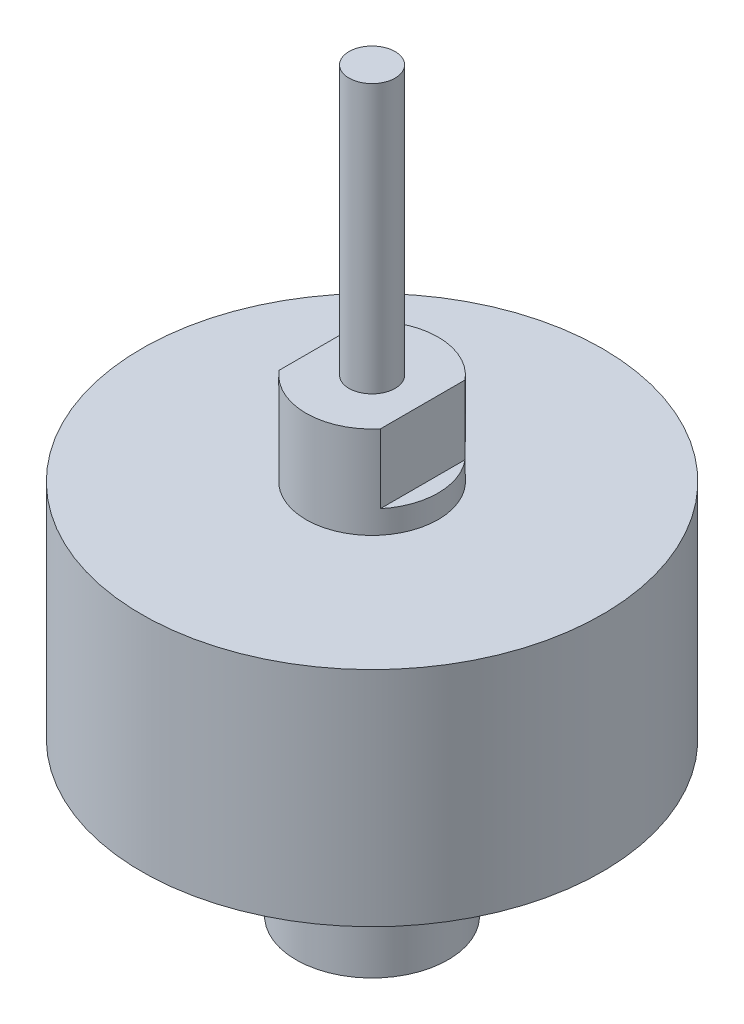
from build123d import *

# Parameters (mm, degrees)
SKETCH1_R           = 4.95
BOSS_EXTRUDE1_DEPTH = 6
SKETCH2_R           = 5.5
BOSS_EXTRUDE2_DEPTH = 4
SKETCH3_R           = 15
BOSS_EXTRUDE3_DEPTH = 14.5
SKETCH4_R           = 4.3
BOSS_EXTRUDE4_DEPTH = 1.5
BOSS_EXTRUDE5_DEPTH = 4.5
SKETCH6_R           = 1.5
BOSS_EXTRUDE6_DEPTH = 17.5


with BuildPart() as part:
    # Sketch1 → Boss-Extrude1 (new body)
    with BuildSketch(Plane(origin=(0, 0, 0), x_dir=(1, 0, 0), z_dir=(0, 1, 0))):
        with Locations(Location((0, 0, 0), (0, 0, 270))):
            Circle(SKETCH1_R)
    extrude(amount=BOSS_EXTRUDE1_DEPTH)

    # Sketch2 → Boss-Extrude2 (add)
    with BuildSketch(Plane(origin=(0, 6, 0), x_dir=(1, 0, 0), z_dir=(0, 1, 0))):
        with Locations(Location((0, 0, 0), (0, 0, 270))):
            Circle(SKETCH2_R)
    extrude(amount=BOSS_EXTRUDE2_DEPTH)

    # Sketch3 → Boss-Extrude3 (add)
    with BuildSketch(Plane(origin=(0, 10, 0), x_dir=(1, 0, 0), z_dir=(0, 1, 0))):
        with Locations(Location((0, 0, 0), (0, 0, 90))):
            Circle(SKETCH3_R)
    extrude(amount=BOSS_EXTRUDE3_DEPTH)

    # Sketch4 → Boss-Extrude4 (add)
    with BuildSketch(Plane(origin=(0, 24.5, 0), x_dir=(1, 0, 0), z_dir=(0, 1, 0))):
        with Locations(Location((0, 0, 0), (0, 0, 270))):
            Circle(SKETCH4_R)
    extrude(amount=BOSS_EXTRUDE4_DEPTH)

    # Sketch5 → Boss-Extrude5 (add)
    with BuildSketch(Plane(origin=(0, 26, 0), x_dir=(1, 0, 0), z_dir=(0, 1, 0))):
        with BuildLine():
            Line((-3.3, 2.75680975), (-3.3, -2.75680975))
            ThreePointArc((-3.3, -2.75680975), (0, -4.3), (3.3, -2.75680975))
            Line((3.3, -2.75680975), (3.3, 2.75680975))
            ThreePointArc((3.3, 2.75680975), (0, 4.3), (-3.3, 2.75680975))
        make_face()
    extrude(amount=BOSS_EXTRUDE5_DEPTH)

    # Sketch6 → Boss-Extrude6 (add)
    with BuildSketch(Plane(origin=(0, 30.5, 0), x_dir=(1, 0, 0), z_dir=(0, 1, 0))):
        with Locations(Location((0, 0, 0), (0, 0, 270))):
            Circle(SKETCH6_R)
    extrude(amount=BOSS_EXTRUDE6_DEPTH)


solid = part.part
